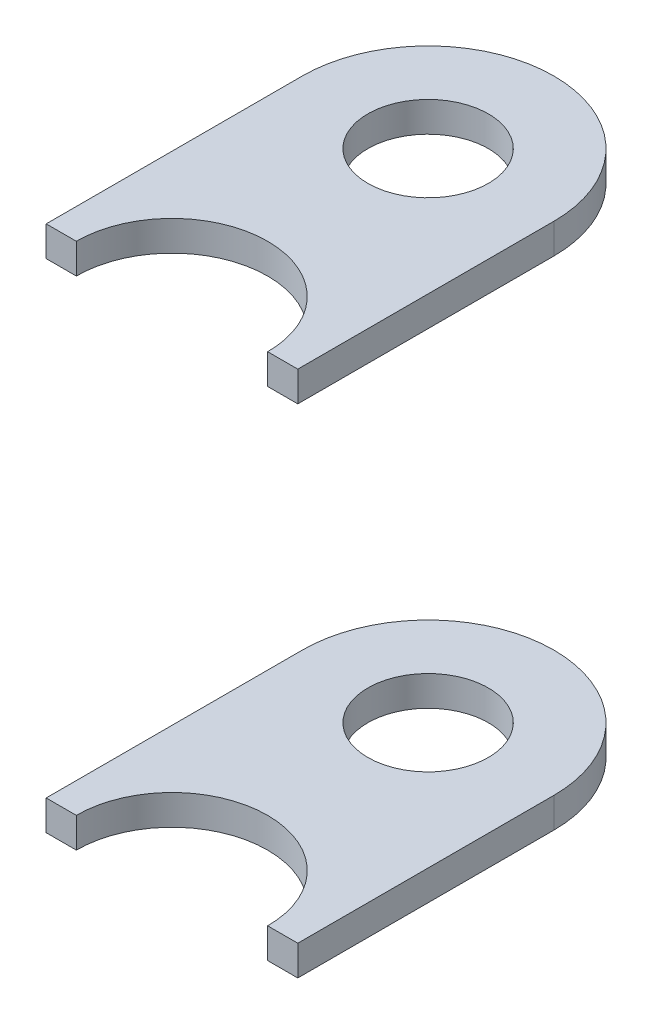
from build123d import *

# Parameters (mm, degrees)
SKETCH1_R           = 8
BOSS_EXTRUDE1_DEPTH = 4


with BuildPart() as part:
    # Sketch1 → Boss-Extrude1 (new body)
    with BuildSketch(Plane(origin=(0, 31, 0), x_dir=(1, 0, 0), z_dir=(0, 1, 0))):
        with BuildLine():
            Line((16.7, -34), (12.7, -34))
            ThreePointArc((12.7, -34), (0, -21.3), (-12.7, -34))
            Line((-12.7, -34), (-16.7, -34))
            Line((-16.7, -34), (-16.7, 0))
            ThreePointArc((-16.7, 0), (0, 16.7), (16.7, 0))
            Line((16.7, 0), (16.7, -34))
        make_face()
        Circle(SKETCH1_R, mode=Mode.SUBTRACT)
    extrude(amount=BOSS_EXTRUDE1_DEPTH)


with BuildPart() as body_2:
    # Mirror2: mirrored copy
    add(part.part.mirror(Plane.ZX))


solid = Compound([part.part, body_2.part])
